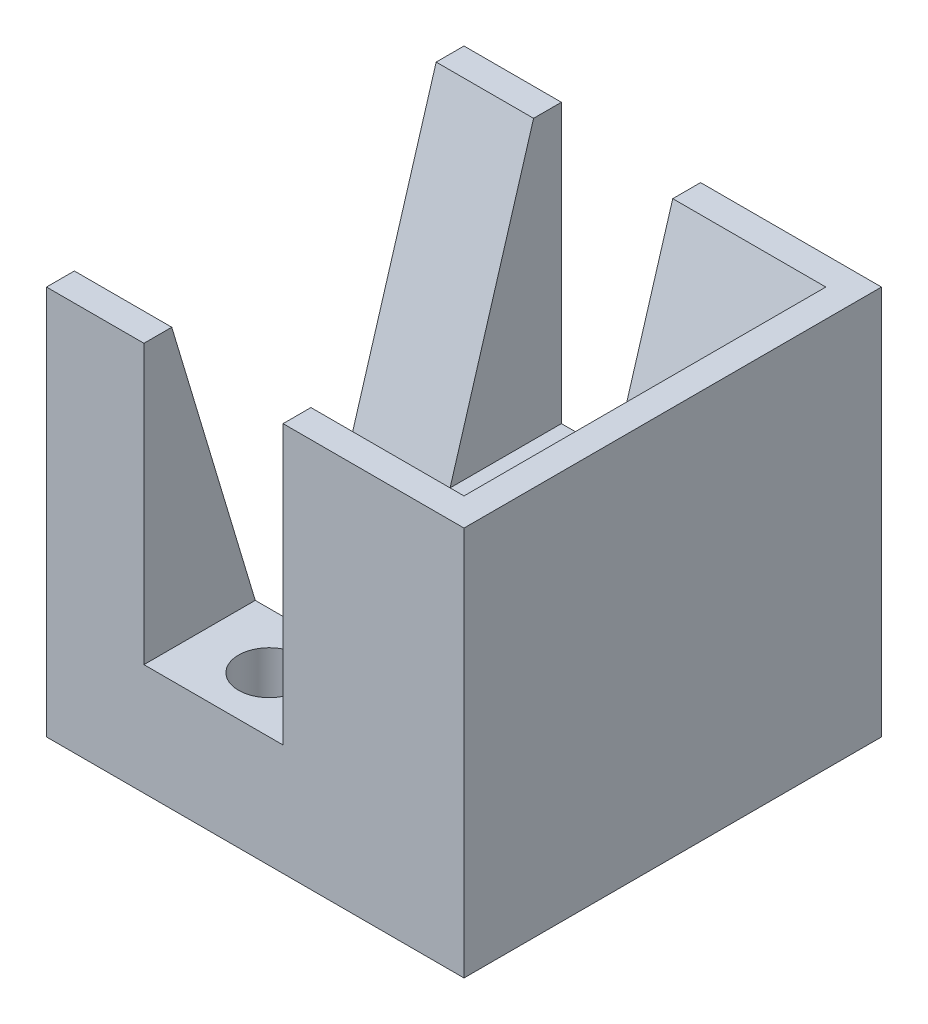
from build123d import *

# Parameters (mm, degrees)
SKETCH_1_W          = 10
SKETCH_1_H          = 4
EXTRUDE_1_DEPTH     = 4
SKETCH_2_W          = 5
SKETCH_2_H          = 11
EXTRUDE_2_DEPTH     = 4
SKETCH_3_W          = 15
SKETCH_3_H          = 4
EXTRUDE_3_DEPTH     = 4
SKETCH_4_R          = 1.1
CUT_EXTRUDE_1_DEPTH = 17.881943016
SKETCH_5_W          = 3.5
SKETCH_5_H          = 4
EXTRUDE_6_DEPTH     = 10
SKETCH_9_W          = 6.5
SKETCH_9_H          = 4
EXTRUDE_7_DEPTH     = 10
SKETCH_11_W         = 5
SKETCH_11_H         = 7
EXTRUDE_8_DEPTH     = 10
CUT_EXTRUDE_3_REACH = 26.29
CHAMFER_2_SIZE      = 10
CHAMFER_2_SIZE2     = 4


with BuildPart() as part:
    # 草图1 → 凸台-拉伸1 (new body)
    with BuildSketch(Plane(origin=(0, 0, 0), x_dir=(1, 0, 0), z_dir=(0, 1, 0))):
        Rectangle(SKETCH_1_W, SKETCH_1_H)
    extrude(amount=EXTRUDE_1_DEPTH)

    # 草图2 → 凸台-拉伸2 (add)
    with BuildSketch(Plane(origin=(0, 4, 0), x_dir=(1, 0, 0), z_dir=(0, 1, 0))):
        with Locations((7.5, -3.5)):
            Rectangle(SKETCH_2_W, SKETCH_2_H)
    extrude(amount=-EXTRUDE_2_DEPTH)

    # 草图3 → 凸台-拉伸3 (add)
    with BuildSketch(Plane(origin=(0, 4, 0), x_dir=(1, 0, 0), z_dir=(0, 1, 0))):
        with Locations((2.5, -11)):
            Rectangle(SKETCH_3_W, SKETCH_3_H)
    extrude(amount=-EXTRUDE_3_DEPTH)

    # 草图4 → 切除-拉伸1 (cut, through all)
    with BuildSketch(Plane(origin=(0, 4, 0), x_dir=(1, 0, 0), z_dir=(0, 1, 0))):
        with Locations(Location((1, -11, 0), (0, 0, 270))):
            Circle(SKETCH_4_R)
        with Locations(Location((1, 0, 0), (0, 0, 270))):
            Circle(SKETCH_4_R)
    extrude(amount=-CUT_EXTRUDE_1_DEPTH, mode=Mode.SUBTRACT)

    # 草图5 → 凸台-拉伸6 (add)
    with BuildSketch(Plane(origin=(0, 4, 0), x_dir=(1, 0, 0), z_dir=(0, 1, 0))):
        with Locations((-3.25, -11)):
            Rectangle(SKETCH_5_W, SKETCH_5_H)
        with Locations((-3.25, 0)):
            Rectangle(SKETCH_5_W, SKETCH_5_H)
    extrude(amount=EXTRUDE_6_DEPTH)

    # 草图9 → 凸台-拉伸7 (add)
    with BuildSketch(Plane(origin=(0, 4, 0), x_dir=(1, 0, 0), z_dir=(0, 1, 0))):
        with Locations((6.75, 0)):
            Rectangle(SKETCH_9_W, SKETCH_9_H)
        with Locations((6.75, -11)):
            Rectangle(SKETCH_9_W, SKETCH_9_H)
    extrude(amount=EXTRUDE_7_DEPTH)

    # 草图11 → 凸台-拉伸8 (add)
    with BuildSketch(Plane(origin=(0, 4, 0), x_dir=(1, 0, 0), z_dir=(0, 1, 0))):
        with Locations((7.5, -5.5)):
            Rectangle(SKETCH_11_W, SKETCH_11_H)
    extrude(amount=EXTRUDE_8_DEPTH)

    # 切除-拉伸3: up to this face of the body (flat: up to its plane)
    cut_extrude_3_end = Plane(part.part.faces().sort_by_distance((5, 7, 5.5))[0])
    # 草图8 → 切除-拉伸3 (cut, up to the picked face)
    with BuildSketch(Plane.ZY.offset(5), mode=Mode.PRIVATE) as cut_extrude_3_sk1:
        Polygon((2, 4), (-1, 14), (2, 14), align=None)
    cut_extrude_3_tool1 = split(extrude(cut_extrude_3_sk1.sketch, amount=-CUT_EXTRUDE_3_REACH, mode=Mode.PRIVATE), bisect_by=cut_extrude_3_end, keep=Keep.BOTH, mode=Mode.PRIVATE)
    # 草图8 → 切除-拉伸3 (cut, up to the picked face)
    with BuildSketch(Plane.ZY.offset(5), mode=Mode.PRIVATE) as cut_extrude_3_sk2:
        Polygon((12, 14), (9, 4), (9, 14), align=None)
    cut_extrude_3_tool2 = split(extrude(cut_extrude_3_sk2.sketch, amount=-CUT_EXTRUDE_3_REACH, mode=Mode.PRIVATE), bisect_by=cut_extrude_3_end, keep=Keep.BOTH, mode=Mode.PRIVATE)
    add(cut_extrude_3_tool1.solids().sort_by(Axis((-5, 10.666667, 1), (1, 0, 0)))[0], mode=Mode.SUBTRACT)
    add(cut_extrude_3_tool2.solids().sort_by(Axis((-5, 10.666667, 10), (1, 0, 0)))[0], mode=Mode.SUBTRACT)

    # 倒角2
    chamfer_2_edges = [part.edges().sort_by_distance(p)[0] for p in [
        (5, 14, 5.5),
    ]]
    chamfer_2_side = [part.faces().sort_by_distance(p)[0] for p in [
        (5, 7.859375, 5.5),
    ]]
    chamfer(chamfer_2_edges, length=CHAMFER_2_SIZE, length2=CHAMFER_2_SIZE2, reference=chamfer_2_side[0])


solid = part.part
